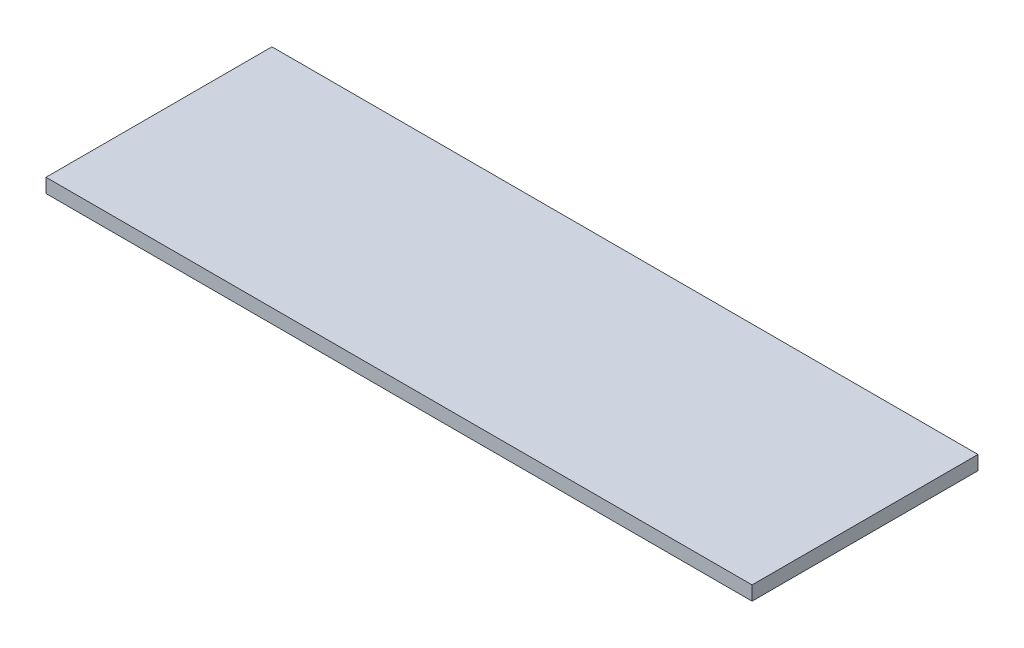
from build123d import *

# Parameters (mm, degrees)
SKETCH1_W           = 635
SKETCH1_H           = 203.2
BOSS_EXTRUDE1_DEPTH = 12.7


with BuildPart() as part:
    # Sketch1 → Boss-Extrude1 (new body)
    with BuildSketch(Plane(origin=(0, 0, 0), x_dir=(1, 0, 0), z_dir=(0, 1, 0))):
        Rectangle(SKETCH1_W, SKETCH1_H)
    extrude(amount=BOSS_EXTRUDE1_DEPTH)


solid = part.part
